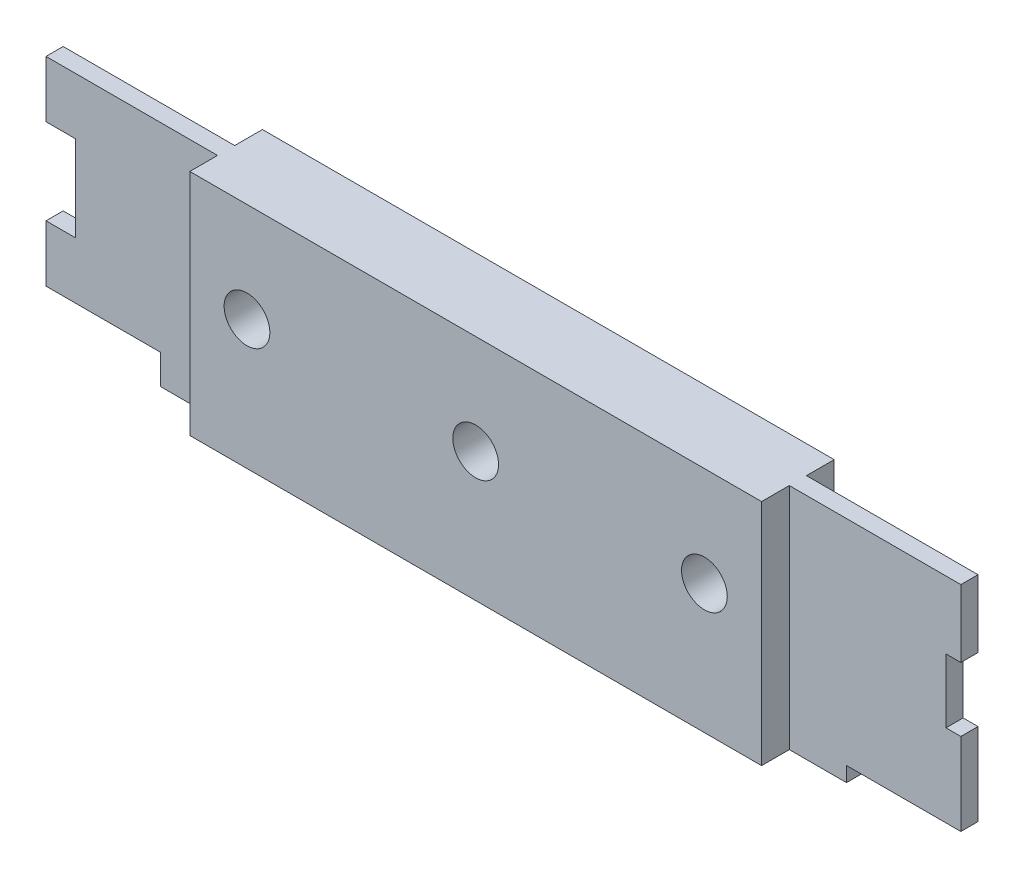
from build123d import *

# Parameters (mm, degrees)
CROQUIS1_R              = 2
SALIENTE_EXTRUIR1_DEPTH = 0.75
CROQUIS2_W              = 50
CROQUIS2_H              = 20
CROQUIS2_R              = 2
SALIENTE_EXTRUIR2_DEPTH = 3.175


with BuildPart() as part:
    # Croquis1 → Saliente-Extruir1 (new, symmetric)
    with BuildSketch(Plane.XY):
        Polygon((-40, 8.7), (40, 8.7), (40, 2.8), (38.7, 2.8), (38.7, -2.8), (40, -2.8), (40, -10), (30, -10), (30, -11.3), (-30, -11.3), (-30, -8.7), (-40, -8.7), (-40, -3.75), (-37.4, -3.75), (-37.4, 3.75), (-40, 3.75), align=None)
        with Locations((20, 0)):
            Circle(CROQUIS1_R, mode=Mode.SUBTRACT)
        Circle(CROQUIS1_R, mode=Mode.SUBTRACT)
        with Locations((-20, 0)):
            Circle(CROQUIS1_R, mode=Mode.SUBTRACT)
    extrude(amount=SALIENTE_EXTRUIR1_DEPTH, both=True)

    # Croquis2 → Saliente-Extruir2 (add, symmetric)
    with BuildSketch(Plane.XY):
        with Locations((0, -1.3)):
            Rectangle(CROQUIS2_W, CROQUIS2_H)
        with Locations((-20, 0)):
            Circle(CROQUIS2_R, mode=Mode.SUBTRACT)
        Circle(CROQUIS2_R, mode=Mode.SUBTRACT)
        with Locations((20, 0)):
            Circle(CROQUIS2_R, mode=Mode.SUBTRACT)
    extrude(amount=SALIENTE_EXTRUIR2_DEPTH, both=True)


solid = part.part
